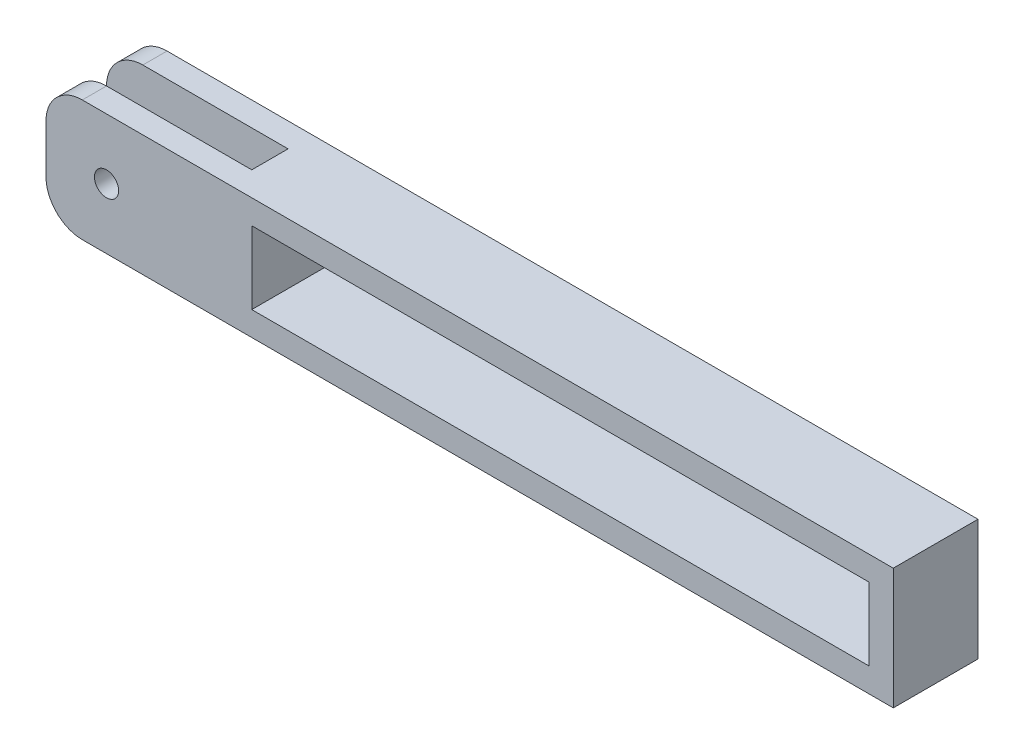
from build123d import *

# Parameters (mm, degrees)
EXTRUDE1_DEPTH          = 17.5
SKETCH2_W               = 75
SKETCH2_H               = 15
CUT_EXTRUDE1_DEPTH      = 330.289006801
CUT_EXTRUDE2_DEPTH      = 327.429548295
CUT_EXTRUDE2_DEPTH_BACK = 327.429548295
SKETCH3_R               = 5
CUT_EXTRUDE3_DEPTH      = 327.429548295
CUT_EXTRUDE3_DEPTH_BACK = 327.429548295
SKETCH4_W               = 255
SKETCH4_H               = 30


with BuildPart() as part:
    # Sketch1 → Extrude1 (new, symmetric)
    with BuildSketch(Plane.XY):
        with BuildLine():
            Line((-10, 25), (325, 25))
            Line((325, 25), (325, -25))
            Line((325, -25), (-10, -25))
            ThreePointArc((-10, -25), (-20.606601718, -20.606601718), (-25, -10))
            Line((-25, -10), (-25, 10))
            ThreePointArc((-25, 10), (-20.606601718, 20.606601718), (-10, 25))
        make_face()
    extrude(amount=EXTRUDE1_DEPTH, both=True)

    # Sketch2 → Cut-Extrude1 (cut, through all)
    with BuildSketch(Plane(origin=(0, 25, 0), x_dir=(-1, 0, 0), z_dir=(0, 1, 0))):
        with Locations((-12.5, 0)):
            Rectangle(SKETCH2_W, SKETCH2_H)
    extrude(amount=-CUT_EXTRUDE1_DEPTH, mode=Mode.SUBTRACT)

    # Sketch3 → Cut-Extrude2 (cut, two sides: drawn at the far end of the back side and taken through both)
    with BuildSketch(Plane.XY.offset(-CUT_EXTRUDE2_DEPTH_BACK)):
        Circle(SKETCH3_R)
    extrude(amount=CUT_EXTRUDE2_DEPTH + CUT_EXTRUDE2_DEPTH_BACK, mode=Mode.SUBTRACT)

    # Sketch4 → Cut-Extrude3 (cut, two sides: drawn at the far end of the back side and taken through both)
    with BuildSketch(Plane.XY.offset(-CUT_EXTRUDE3_DEPTH_BACK)):
        with Locations((187.5, 0)):
            Rectangle(SKETCH4_W, SKETCH4_H)
    extrude(amount=CUT_EXTRUDE3_DEPTH + CUT_EXTRUDE3_DEPTH_BACK, mode=Mode.SUBTRACT)


solid = part.part
